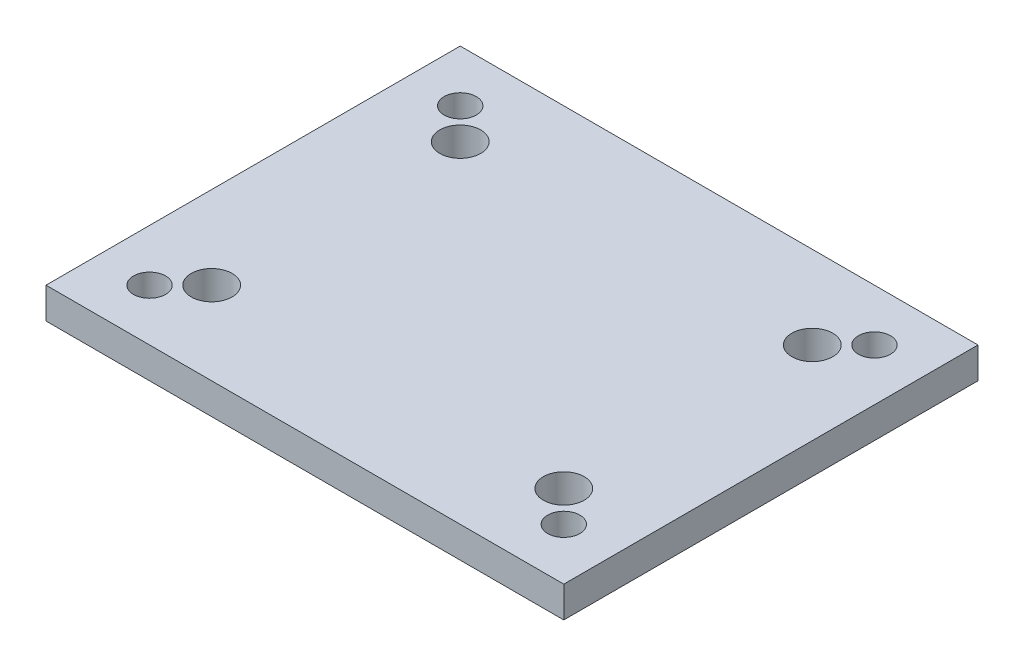
from build123d import *

# Parameters (mm, degrees)
SKETCH1_W           = 50
SKETCH1_H           = 40
SKETCH1_R           = 1.55
SKETCH1_R_2         = 1.975
BOSS_EXTRUDE1_DEPTH = 3


with BuildPart() as part:
    # Sketch1 → Boss-Extrude1 (new body)
    with BuildSketch(Plane(origin=(0, 0, 0), x_dir=(1, 0, 0), z_dir=(0, 1, 0))):
        with Locations((25, 20)):
            Rectangle(SKETCH1_W, SKETCH1_H)
        with Locations(Location((5, 35, 0), (0, 0, 270))):
            Circle(SKETCH1_R, mode=Mode.SUBTRACT)
        with Locations(Location((45, 35, 0), (0, 0, 270))):
            Circle(SKETCH1_R, mode=Mode.SUBTRACT)
        with Locations(Location((5, 5, 0), (0, 0, 270))):
            Circle(SKETCH1_R, mode=Mode.SUBTRACT)
        with Locations(Location((45, 5, 0), (0, 0, 270))):
            Circle(SKETCH1_R, mode=Mode.SUBTRACT)
        with Locations(Location((8, 32, 0), (0, 0, 270))):
            Circle(SKETCH1_R_2, mode=Mode.SUBTRACT)
        with Locations(Location((42, 32, 0), (0, 0, 270))):
            Circle(SKETCH1_R_2, mode=Mode.SUBTRACT)
        with Locations(Location((8, 8, 0), (0, 0, 270))):
            Circle(SKETCH1_R_2, mode=Mode.SUBTRACT)
        with Locations(Location((42, 8, 0), (0, 0, 270))):
            Circle(SKETCH1_R_2, mode=Mode.SUBTRACT)
    extrude(amount=BOSS_EXTRUDE1_DEPTH)


solid = part.part
